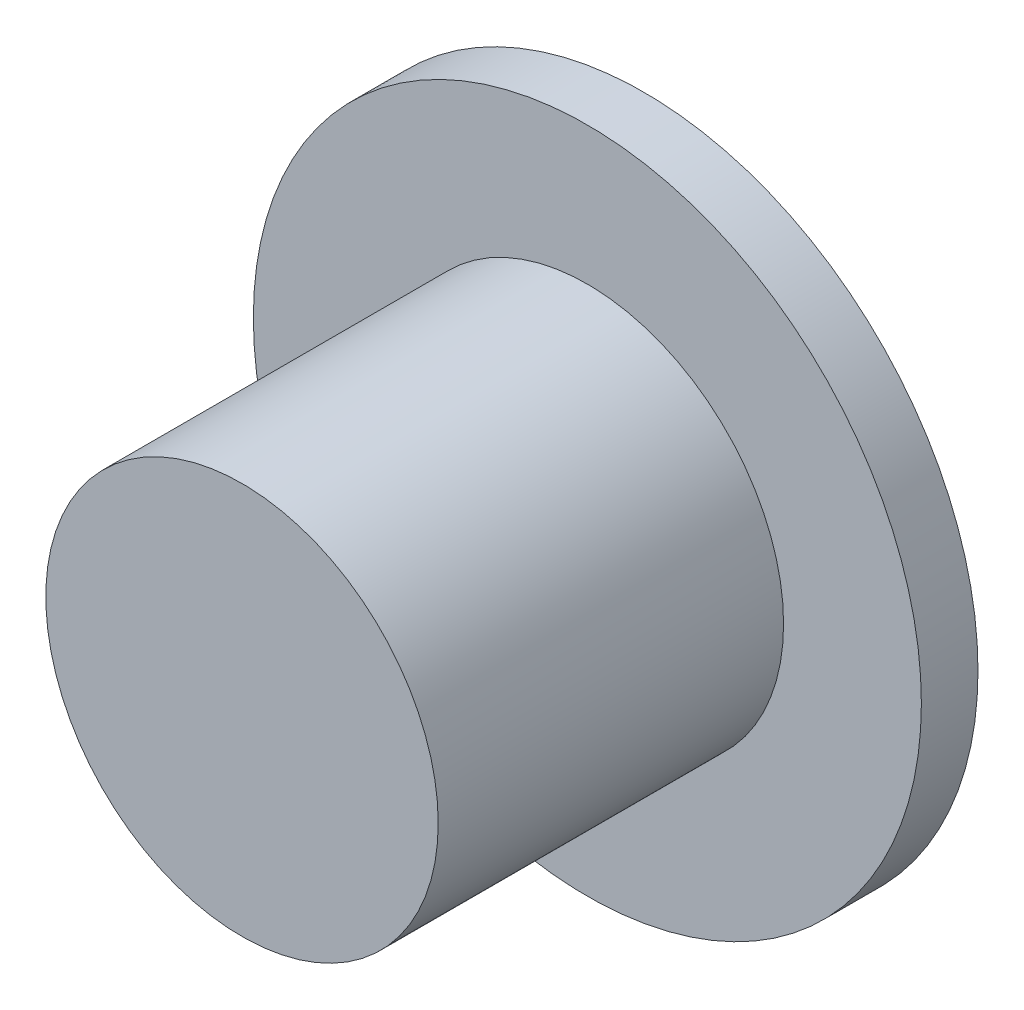
from build123d import *

# Parameters (mm, degrees)
SKETCH1_R           = 58.998448378
BOSS_EXTRUDE1_DEPTH = 10
SKETCH2_R           = 34.657790165
BOSS_EXTRUDE2_DEPTH = 61


with BuildPart() as part:
    # Sketch1 → Boss-Extrude1 (new body)
    with BuildSketch(Plane.XY):
        Circle(SKETCH1_R)
    extrude(amount=BOSS_EXTRUDE1_DEPTH)

    # Sketch2 → Boss-Extrude2 (add)
    with BuildSketch(Plane.XY.offset(10)):
        Circle(SKETCH2_R)
    extrude(amount=BOSS_EXTRUDE2_DEPTH)


solid = part.part
